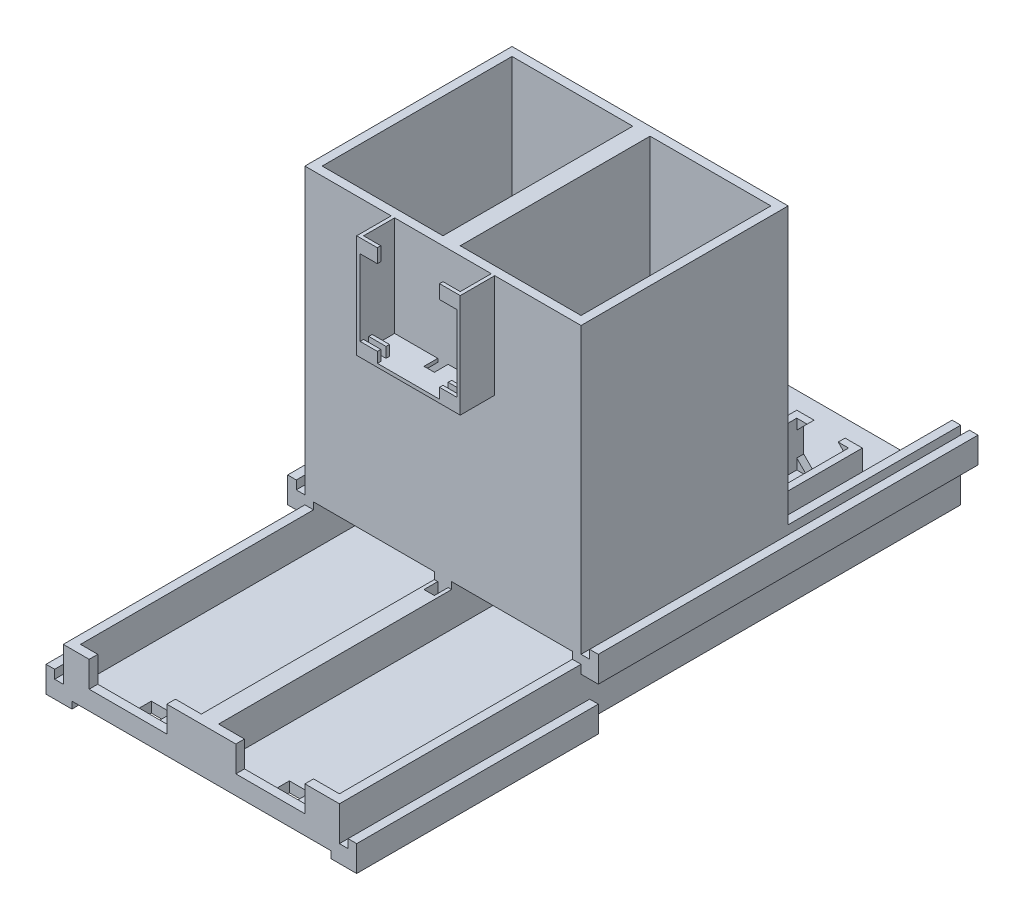
from build123d import *

# Parameters (mm, degrees)
SKETCH1_W                                   = 80
SKETCH1_H                                   = 60
BOSS_EXTRUDE1_DEPTH                         = 100
CUT_EXTRUDE1_START                          = 5
SKETCH2_W                                   = 35
SKETCH2_H                                   = 55
CUT_EXTRUDE1_DEPTH                          = 95
SKETCH3_W                                   = 80
SKETCH3_H                                   = 5
BOSS_EXTRUDE2_DEPTH                         = 70
BOSS_EXTRUDE3_DEPTH                         = 10
SKETCH5_W                                   = 22.5
SKETCH5_H                                   = 2.5
SKETCH5_W_2                                 = 20
CUT_EXTRUDE2_DEPTH                          = 7.5
SKETCH6_W                                   = 35
SKETCH6_H                                   = 12
CUT_EXTRUDE4_DEPTH                          = 57.5
CUT_EXTRUDE6_REACH                          = 184.483
SKETCH7_R                                   = 4
SKETCH9_W                                   = 80
SKETCH9_H                                   = 50
BOSS_EXTRUDE4_DEPTH                         = 5
SKETCH11_W                                  = 75
SKETCH11_H                                  = 32.5
CUT_EXTRUDE7_DEPTH                          = 2
SKETCH13_W                                  = 6
SKETCH13_H                                  = 6
CUT_EXTRUDE8_DEPTH                          = 166.90660023
BOSS_EXTRUDE5_DEPTH                         = 10
SKETCH15_W                                  = 6
SKETCH15_H                                  = 4
BOSS_EXTRUDE6_DEPTH                         = 1
BOSS_EXTRUDE7_START                         = -2.5
SKETCH15_2_W                                = 6
SKETCH15_2_H                                = 4
BOSS_EXTRUDE7_DEPTH                         = 1
SKETCH17_W                                  = 6
SKETCH17_H                                  = 4
BOSS_EXTRUDE8_DEPTH                         = 1
SKETCH18_W                                  = 3
SKETCH18_H                                  = 4
CUT_EXTRUDE9_OLED_CABLE_DEPTH               = 154.430766146
SKETCH20_W                                  = 5
SKETCH20_H                                  = 5
CUT_EXTRUDE10_SOLENOID_WIRE_DEPTH           = 166.90660023
SKETCH21_W                                  = 2
SKETCH21_H                                  = 32
BOSS_EXTRUDE9_SOLENOID_SIDE_SUPPORT_DEPTH   = 13
BOSS_EXTRUDE12_SOLENOID_REAR_SUPPORT_DEPTH  = 2
SKETCH27_W                                  = 2.5
SKETCH27_H                                  = 50
BOSS_EXTRUDE13_SOLENOID_SECTION_WALLS_DEPTH = 15
SKETCH29_W                                  = 70
SKETCH29_H                                  = 5
SKETCH29_W_2                                = 110
BOSS_EXTRUDE14_GUIDE_DEPTH                  = 5
BOSS_EXTRUDE15_START                        = -80
SKETCH29_2_W                                = 70
SKETCH29_2_H                                = 5
SKETCH29_2_W_2                              = 110
BOSS_EXTRUDE15_DEPTH                        = 5
SKETCH30_W                                  = 110
SKETCH30_H                                  = 2.5
SKETCH30_W_2                                = 70
BOSS_EXTRUDE16_DEPTH                        = 2.5
BOSS_EXTRUDE17_START                        = -87.5
SKETCH30_2_W                                = 110
SKETCH30_2_H                                = 2.5
SKETCH30_2_W_2                              = 70
BOSS_EXTRUDE17_DEPTH                        = 2.5


with BuildPart() as part:
    # Sketch1 → Boss-Extrude1 (new body)
    with BuildSketch(Plane(origin=(0, 0, 0), x_dir=(1, 0, 0), z_dir=(0, 1, 0))):
        with Locations((40, 30)):
            Rectangle(SKETCH1_W, SKETCH1_H)
    extrude(amount=BOSS_EXTRUDE1_DEPTH)

    # Sketch2 → Cut-Extrude1 (cut)
    with BuildSketch(Plane(origin=(0, 0, 0), x_dir=(1, 0, 0), z_dir=(0, 1, 0)).offset(CUT_EXTRUDE1_START)):
        with Locations((20, 30)):
            Rectangle(SKETCH2_W, SKETCH2_H)
        with Locations((60, 30)):
            Rectangle(SKETCH2_W, SKETCH2_H)
    extrude(amount=CUT_EXTRUDE1_DEPTH, mode=Mode.SUBTRACT)

    # Sketch3 → Boss-Extrude2 (add)
    with BuildSketch(Plane.XY):
        with Locations((40, 2.5)):
            Rectangle(SKETCH3_W, SKETCH3_H)
    extrude(amount=BOSS_EXTRUDE2_DEPTH)

    # Sketch4 → Boss-Extrude3 (add)
    with BuildSketch(Plane(origin=(0, 5, 0), x_dir=(1, 0, 0), z_dir=(0, 1, 0))):
        Polygon((80, 0), (77.5, 0), (77.5, -67.5), (42.5, -67.5), (42.5, 0), (37.5, 0), (37.5, -67.5), (2.5, -67.5), (2.5, 0), (0, 0), (0, -70), (80, -70), align=None)
    extrude(amount=BOSS_EXTRUDE3_DEPTH)

    # Sketch5 → Cut-Extrude2 (cut)
    with BuildSketch(Plane(origin=(0, 15, 0), x_dir=(1, 0, 0), z_dir=(0, 1, 0))):
        with Locations((18.75, -68.75)):
            Rectangle(SKETCH5_W, SKETCH5_H)
        with Locations((60, -68.75)):
            Rectangle(SKETCH5_W_2, SKETCH5_H)
    extrude(amount=-CUT_EXTRUDE2_DEPTH, mode=Mode.SUBTRACT)

    # Sketch6 → Cut-Extrude4 (cut)
    with BuildSketch(Plane.XY):
        with Locations((20, 11)):
            Rectangle(SKETCH6_W, SKETCH6_H)
        with Locations((60, 11)):
            Rectangle(SKETCH6_W, SKETCH6_H)
    extrude(amount=-CUT_EXTRUDE4_DEPTH, mode=Mode.SUBTRACT)

    # Sketch7 → Cut-Extrude6 (cut, up to next)
    with BuildSketch(Plane(origin=(0, 0, -60), x_dir=(-1, 0, 0), z_dir=(0, 0, -1)), mode=Mode.PRIVATE) as cut_extrude6_sk1:
        with Locations((-20, 11.5)):
            Circle(SKETCH7_R)
    cut_extrude6_tool1 = extrude(cut_extrude6_sk1.sketch, amount=-CUT_EXTRUDE6_REACH, mode=Mode.PRIVATE) & part.part
    # Sketch7 → Cut-Extrude6 (cut, up to next)
    with BuildSketch(Plane(origin=(0, 0, -60), x_dir=(-1, 0, 0), z_dir=(0, 0, -1)), mode=Mode.PRIVATE) as cut_extrude6_sk2:
        with Locations((-60, 11.5)):
            Circle(SKETCH7_R)
    cut_extrude6_tool2 = extrude(cut_extrude6_sk2.sketch, amount=-CUT_EXTRUDE6_REACH, mode=Mode.PRIVATE) & part.part
    add(cut_extrude6_tool1.solids().sort_by_distance((20, 11.5, -60))[0], mode=Mode.SUBTRACT)
    add(cut_extrude6_tool2.solids().sort_by_distance((60, 11.5, -60))[0], mode=Mode.SUBTRACT)

    # Sketch9 → Boss-Extrude4 (add)
    with BuildSketch(Plane(origin=(0, 0, 0), x_dir=(1, 0, 0), z_dir=(0, 1, 0))):
        with Locations((40, 85)):
            Rectangle(SKETCH9_W, SKETCH9_H)
    extrude(amount=BOSS_EXTRUDE4_DEPTH)

    # Sketch11 → Cut-Extrude7 (cut)
    with BuildSketch(Plane.XZ):
        with Locations((40, 53.75)):
            Rectangle(SKETCH11_W, SKETCH11_H)
    extrude(amount=-CUT_EXTRUDE7_DEPTH, mode=Mode.SUBTRACT)

    # Sketch13 → Cut-Extrude8 (cut, through all)
    with BuildSketch(Plane(origin=(0, 5, 0), x_dir=(1, 0, 0), z_dir=(0, 1, 0))):
        with Locations((20, -64.5)):
            Rectangle(SKETCH13_W, SKETCH13_H)
        with Locations((60, -64.5)):
            Rectangle(SKETCH13_W, SKETCH13_H)
    extrude(amount=-CUT_EXTRUDE8_DEPTH, mode=Mode.SUBTRACT)

    # Sketch14 → Boss-Extrude5 (add)
    with BuildSketch(Plane.XY):
        Polygon((25, 100), (26, 100), (26, 71), (54, 71), (54, 100), (55, 100), (55, 70), (54, 70), (26, 70), (25, 70), align=None)
    extrude(amount=BOSS_EXTRUDE5_DEPTH)

    # Sketch15 → Boss-Extrude6 (add)
    with BuildSketch(Plane.XY.offset(10)):
        with Locations((28, 72)):
            Rectangle(SKETCH15_W, SKETCH15_H)
        with Locations((52, 72)):
            Rectangle(SKETCH15_W, SKETCH15_H)
    extrude(amount=-BOSS_EXTRUDE6_DEPTH)

    # Sketch15<2> → Boss-Extrude7 (add)
    with BuildSketch(Plane.XY.offset(10).offset(BOSS_EXTRUDE7_START)):
        with Locations((28, 72)):
            Rectangle(SKETCH15_2_W, SKETCH15_2_H)
        with Locations((52, 72)):
            Rectangle(SKETCH15_2_W, SKETCH15_2_H)
    extrude(amount=-BOSS_EXTRUDE7_DEPTH)

    # Sketch17 → Boss-Extrude8 (add)
    with BuildSketch(Plane.XY.offset(10)):
        with Locations((28, 98)):
            Rectangle(SKETCH17_W, SKETCH17_H)
        with Locations((52, 98)):
            Rectangle(SKETCH17_W, SKETCH17_H)
    extrude(amount=-BOSS_EXTRUDE8_DEPTH)

    # Sketch18 → Cut-Extrude9 (OLED Cable) (cut, through all)
    with BuildSketch(Plane(origin=(0, 71, 0), x_dir=(1, 0, 0), z_dir=(0, 1, 0))):
        with Locations((40, -2)):
            Rectangle(SKETCH18_W, SKETCH18_H)
    extrude(amount=-CUT_EXTRUDE9_OLED_CABLE_DEPTH, mode=Mode.SUBTRACT)

    # Sketch20 → Cut-Extrude10 (Solenoid Wire) (cut, through all)
    with BuildSketch(Plane(origin=(0, 5, 0), x_dir=(1, 0, 0), z_dir=(0, 1, 0))):
        with Locations((60, 62.5)):
            Rectangle(SKETCH20_W, SKETCH20_H)
        with Locations((20, 62.5)):
            Rectangle(SKETCH20_W, SKETCH20_H)
    extrude(amount=-CUT_EXTRUDE10_SOLENOID_WIRE_DEPTH, mode=Mode.SUBTRACT)

    # Sketch21 → Boss-Extrude9 (Solenoid Side Support) (add)
    with BuildSketch(Plane(origin=(0, 5, 0), x_dir=(1, 0, 0), z_dir=(0, 1, 0))):
        with Locations((68.5, 76)):
            Rectangle(SKETCH21_W, SKETCH21_H)
        with Locations((51.5, 76)):
            Rectangle(SKETCH21_W, SKETCH21_H)
        with Locations((28.5, 76)):
            Rectangle(SKETCH21_W, SKETCH21_H)
        with Locations((11.5, 76)):
            Rectangle(SKETCH21_W, SKETCH21_H)
    extrude(amount=BOSS_EXTRUDE9_SOLENOID_SIDE_SUPPORT_DEPTH)

    # Sketch25 → Boss-Extrude12 (Solenoid Rear Support) (add)
    with BuildSketch(Plane(origin=(0, 0, -92), x_dir=(-1, 0, 0), z_dir=(0, 0, -1))):
        Polygon((-55.5, 18), (-52.5, 18), (-52.5, 15), align=None)
        Polygon((-52.5, 5), (-52.5, 8), (-55.5, 5), align=None)
        Polygon((-67.5, 18), (-67.5, 15), (-64.5, 18), align=None)
        Polygon((-64.5, 5), (-67.5, 5), (-67.5, 8), align=None)
        Polygon((-15.5, 18), (-12.5, 18), (-12.5, 15), align=None)
        Polygon((-12.5, 5), (-12.5, 8), (-15.5, 5), align=None)
        Polygon((-27.5, 18), (-27.5, 15), (-24.5, 18), align=None)
        Polygon((-24.5, 5), (-27.5, 5), (-27.5, 8), align=None)
    extrude(amount=-BOSS_EXTRUDE12_SOLENOID_REAR_SUPPORT_DEPTH)

    # Sketch27 → Boss-Extrude13 (Solenoid Section Walls) (add)
    with BuildSketch(Plane(origin=(0, 5, 0), x_dir=(1, 0, 0), z_dir=(0, 1, 0))):
        with Locations((78.75, 85)):
            Rectangle(SKETCH27_W, SKETCH27_H)
        with Locations((1.25, 85)):
            Rectangle(SKETCH27_W, SKETCH27_H)
    extrude(amount=BOSS_EXTRUDE13_SOLENOID_SECTION_WALLS_DEPTH)

    # Sketch29 → Boss-Extrude14 (Guide) (add)
    with BuildSketch(Plane(origin=(80, 0, 0), x_dir=(0, 0, -1), z_dir=(1, 0, 0))):
        with Locations((-35, 2.5)):
            Rectangle(SKETCH29_W, SKETCH29_H)
        with Locations((55, 15)):
            Rectangle(SKETCH29_W_2, SKETCH29_H)
    extrude(amount=BOSS_EXTRUDE14_GUIDE_DEPTH)

    # Sketch29<2> → Boss-Extrude15 (add)
    with BuildSketch(Plane(origin=(80, 0, 0), x_dir=(0, 0, -1), z_dir=(1, 0, 0)).offset(BOSS_EXTRUDE15_START)):
        with Locations((-35, 2.5)):
            Rectangle(SKETCH29_2_W, SKETCH29_2_H)
        with Locations((55, 15)):
            Rectangle(SKETCH29_2_W_2, SKETCH29_2_H)
    extrude(amount=-BOSS_EXTRUDE15_DEPTH)

    # Sketch30 → Boss-Extrude16 (add)
    with BuildSketch(Plane(origin=(85, 0, 0), x_dir=(0, 0, -1), z_dir=(1, 0, 0))):
        with Locations((55, 18.75)):
            Rectangle(SKETCH30_W, SKETCH30_H)
        with Locations((-35, 6.25)):
            Rectangle(SKETCH30_W_2, SKETCH30_H)
    extrude(amount=-BOSS_EXTRUDE16_DEPTH)

    # Sketch30<2> → Boss-Extrude17 (add)
    with BuildSketch(Plane(origin=(85, 0, 0), x_dir=(0, 0, -1), z_dir=(1, 0, 0)).offset(BOSS_EXTRUDE17_START)):
        with Locations((55, 18.75)):
            Rectangle(SKETCH30_2_W, SKETCH30_2_H)
        with Locations((-35, 6.25)):
            Rectangle(SKETCH30_2_W_2, SKETCH30_2_H)
    extrude(amount=-BOSS_EXTRUDE17_DEPTH)


solid = part.part
